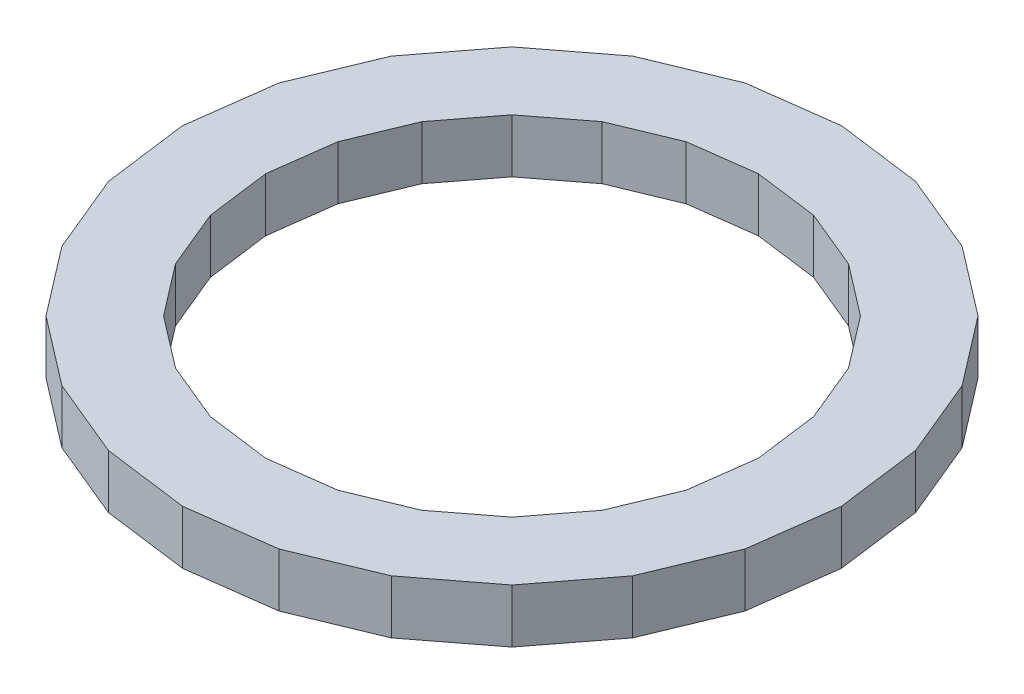
from build123d import *

# Parameters (mm, degrees)
BOSS_EXTRUDE1_DEPTH = 19.05


with BuildPart() as part:
    # Sketch1 → Boss-Extrude1 (new body)
    with BuildSketch(Plane(origin=(0, 0, 0), x_dir=(1, 0, 0), z_dir=(0, 1, 0))):
        Polygon((0, -116.758175051), (30.219239375, -112.779736712), (58.379087526, -101.115545694), (82.560497338, -82.560497338), (101.115545694, -58.379087526), (112.779736712, -30.219239375), (116.758175051, 0), (112.779736712, 30.219239375), (101.115545694, 58.379087526), (82.560497338, 82.560497338), (58.379087526, 101.115545694), (30.219239375, 112.779736712), (0, 116.758175051), (-30.219239375, 112.779736712), (-58.379087526, 101.115545694), (-82.560497338, 82.560497338), (-101.115545694, 58.379087526), (-112.779736712, 30.219239375), (-116.758175051, 0), (-112.779736712, -30.219239375), (-101.115545694, -58.379087526), (-82.560497338, -82.560497338), (-58.379087526, -101.115545694), (-30.219239375, -112.779736712), align=None)
        Polygon((0, -87.296123113), (22.593899225, -84.321579849), (43.648061556, -75.600660267), (61.727680624, -61.727680624), (75.600660267, -43.648061556), (84.321579849, -22.593899225), (87.296123113, 0), (84.321579849, 22.593899225), (75.600660267, 43.648061556), (61.727680624, 61.727680624), (43.648061556, 75.600660267), (22.593899225, 84.321579849), (0, 87.296123113), (-22.593899225, 84.321579849), (-43.648061556, 75.600660267), (-61.727680624, 61.727680624), (-75.600660267, 43.648061556), (-84.321579849, 22.593899225), (-87.296123113, 0), (-84.321579849, -22.593899225), (-75.600660267, -43.648061556), (-61.727680624, -61.727680624), (-43.648061556, -75.600660267), (-22.593899225, -84.321579849), align=None, mode=Mode.SUBTRACT)
    extrude(amount=BOSS_EXTRUDE1_DEPTH)


solid = part.part
